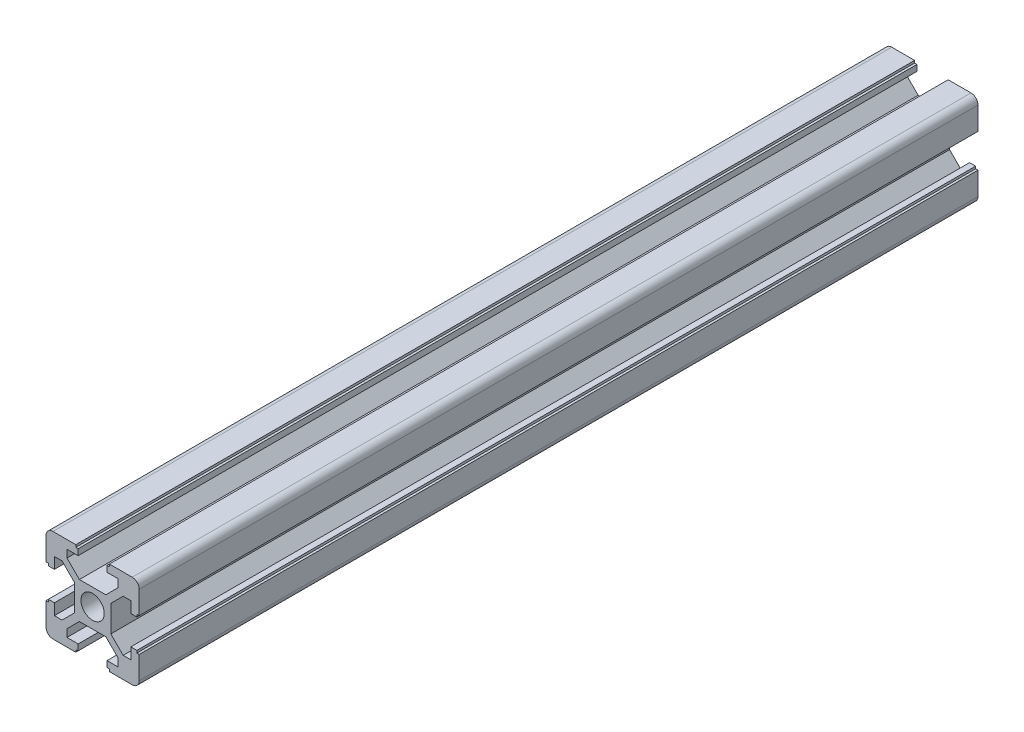
from build123d import *

# Parameters (mm, degrees)
SKETCH1_R           = 2.5
BOSS_EXTRUDE1_DEPTH = 180


with BuildPart() as part:
    # Sketch1 → Boss-Extrude1 (new body)
    with BuildSketch(Plane.XY):
        with BuildLine():
            Line((2.839339828, 3.9), (5.5, 6.560660172))
            Line((5.5, 6.560660172), (5.5, 8.2))
            Line((5.5, 8.2), (3.1, 8.2))
            Line((3.1, 8.2), (3.1, 9.5))
            Line((3.1, 9.5), (3.6, 9.5))
            Line((3.6, 9.5), (3.6, 10))
            Line((3.6, 10), (8.5, 10))
            ThreePointArc((8.5, 10), (9.560660172, 9.560660172), (10, 8.5))
            Line((10, 8.5), (10, 3.6))
            Line((10, 3.6), (9.5, 3.6))
            Line((9.5, 3.6), (9.5, 3.1))
            Line((9.5, 3.1), (8.2, 3.1))
            Line((8.2, 3.1), (8.2, 5.5))
            Line((8.2, 5.5), (6.560660172, 5.5))
            Line((6.560660172, 5.5), (3.9, 2.839339828))
            Line((3.9, 2.839339828), (3.9, -2.839339828))
            Line((3.9, -2.839339828), (6.560660172, -5.5))
            Line((6.560660172, -5.5), (8.2, -5.5))
            Line((8.2, -5.5), (8.2, -3.1))
            Line((8.2, -3.1), (9.5, -3.1))
            Line((9.5, -3.1), (9.5, -3.6))
            Line((9.5, -3.6), (10, -3.6))
            Line((10, -3.6), (10, -8.5))
            ThreePointArc((10, -8.5), (9.560660172, -9.560660172), (8.5, -10))
            Line((8.5, -10), (3.6, -10))
            Line((3.6, -10), (3.6, -9.5))
            Line((3.6, -9.5), (3.1, -9.5))
            Line((3.1, -9.5), (3.1, -8.2))
            Line((3.1, -8.2), (5.5, -8.2))
            Line((5.5, -8.2), (5.5, -6.560660172))
            Line((5.5, -6.560660172), (2.839339828, -3.9))
            Line((2.839339828, -3.9), (-2.839339828, -3.9))
            Line((-2.839339828, -3.9), (-5.5, -6.560660172))
            Line((-5.5, -6.560660172), (-5.5, -8.2))
            Line((-5.5, -8.2), (-3.1, -8.2))
            Line((-3.1, -8.2), (-3.1, -9.5))
            Line((-3.1, -9.5), (-3.6, -9.5))
            Line((-3.6, -9.5), (-3.6, -10))
            Line((-3.6, -10), (-8.5, -10))
            ThreePointArc((-8.5, -10), (-9.560660172, -9.560660172), (-10, -8.5))
            Line((-10, -8.5), (-10, -3.6))
            Line((-10, -3.6), (-9.5, -3.6))
            Line((-9.5, -3.6), (-9.5, -3.1))
            Line((-9.5, -3.1), (-8.2, -3.1))
            Line((-8.2, -3.1), (-8.2, -5.5))
            Line((-8.2, -5.5), (-6.560660172, -5.5))
            Line((-6.560660172, -5.5), (-3.9, -2.839339828))
            Line((-3.9, -2.839339828), (-3.9, 2.839339828))
            Line((-3.9, 2.839339828), (-6.560660172, 5.5))
            Line((-6.560660172, 5.5), (-8.2, 5.5))
            Line((-8.2, 5.5), (-8.2, 3.1))
            Line((-8.2, 3.1), (-9.5, 3.1))
            Line((-9.5, 3.1), (-9.5, 3.6))
            Line((-9.5, 3.6), (-10, 3.6))
            Line((-10, 3.6), (-10, 8.5))
            ThreePointArc((-10, 8.5), (-9.560660172, 9.560660172), (-8.5, 10))
            Line((-8.5, 10), (-3.6, 10))
            Line((-3.6, 10), (-3.6, 9.5))
            Line((-3.6, 9.5), (-3.1, 9.5))
            Line((-3.1, 9.5), (-3.1, 8.2))
            Line((-3.1, 8.2), (-5.5, 8.2))
            Line((-5.5, 8.2), (-5.5, 6.560660172))
            Line((-5.5, 6.560660172), (-2.839339828, 3.9))
            Line((-2.839339828, 3.9), (2.839339828, 3.9))
        make_face()
        with Locations(Location((0, 0.235847297, 0), (0, 0, 180))):
            Circle(SKETCH1_R, mode=Mode.SUBTRACT)
    extrude(amount=BOSS_EXTRUDE1_DEPTH)


solid = part.part
